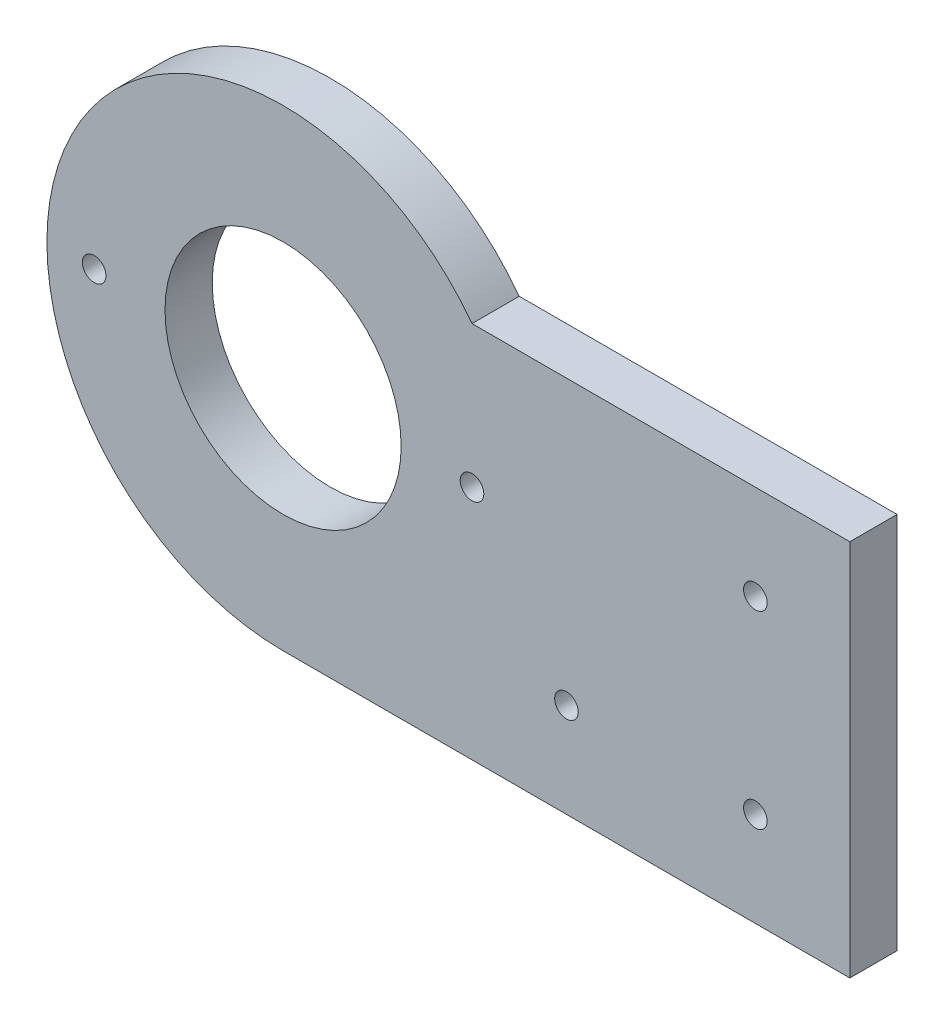
from build123d import *

# Parameters (mm, degrees)
SKETCH1_R           = 15.875
SKETCH1_R_2         = 1.5875
BOSS_EXTRUDE1_DEPTH = 6.35
BOSS_EXTRUDE2_START = -6.35
SKETCH2_R           = 1.5875
BOSS_EXTRUDE2_DEPTH = 6.35


with BuildPart() as part:
    # Sketch1 → Boss-Extrude1 (new body)
    with BuildSketch(Plane.XY):
        with BuildLine():
            Line((0, -31.75), (76.2, -31.75))
            Line((76.2, -31.75), (76.2, -6.35))
            Line((76.2, -6.35), (31.108519733, -6.35))
            ThreePointArc((31.108519733, -6.35), (-20.080463142, 24.593444248), (0, -31.75))
        make_face()
        Circle(SKETCH1_R, mode=Mode.SUBTRACT)
        with Locations((-25.4, 0)):
            Circle(SKETCH1_R_2, mode=Mode.SUBTRACT)
        with Locations((25.4, 0)):
            Circle(SKETCH1_R_2, mode=Mode.SUBTRACT)
        with Locations((38.1, -19.05)):
            Circle(SKETCH1_R_2, mode=Mode.SUBTRACT)
        with Locations((63.5, -19.05)):
            Circle(SKETCH1_R_2, mode=Mode.SUBTRACT)
    extrude(amount=BOSS_EXTRUDE1_DEPTH)

    # Sketch2 → Boss-Extrude2 (add)
    with BuildSketch(Plane.XY.offset(6.35).offset(BOSS_EXTRUDE2_START)):
        with BuildLine():
            Line((76.2, -6.35), (76.2, 19.05))
            Line((76.2, 19.05), (25.4, 19.05))
            ThreePointArc((25.4, 19.05), (30.977301377, 6.961989614), (31.108519733, -6.35))
            Line((31.108519733, -6.35), (76.2, -6.35))
        make_face()
        with Locations((63.5, 6.35)):
            Circle(SKETCH2_R, mode=Mode.SUBTRACT)
    extrude(amount=BOSS_EXTRUDE2_DEPTH)


solid = part.part
